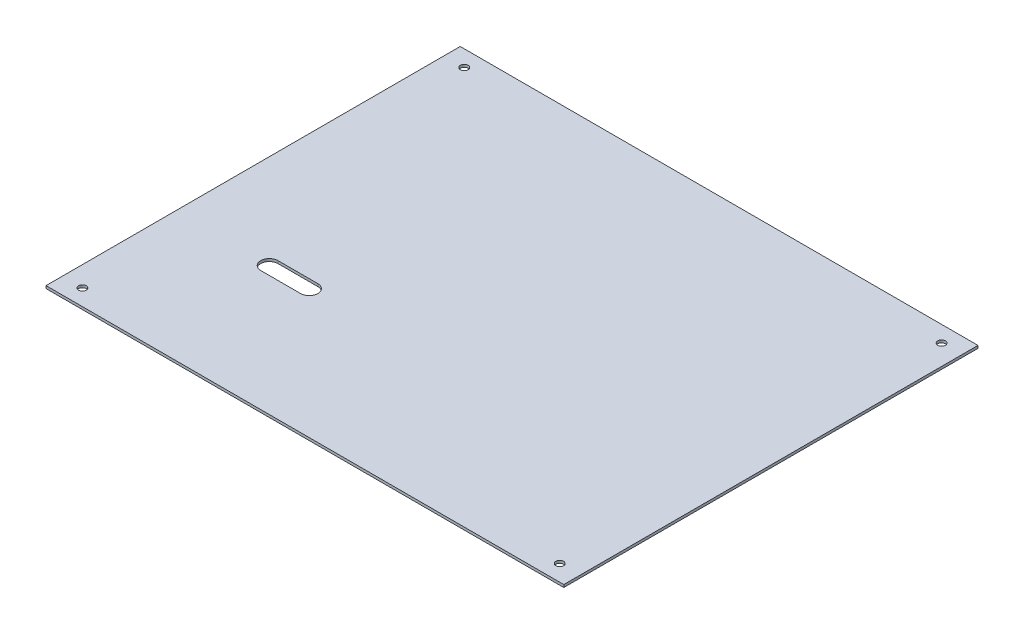
from build123d import *

# Parameters (mm, degrees)
SKETCH1_W           = 200
SKETCH1_H           = 160
SKETCH1_R           = 1.5
BOSS_EXTRUDE1_DEPTH = 1


with BuildPart() as part:
    # Sketch1 → Boss-Extrude1 (new body)
    with BuildSketch(Plane(origin=(0, 0, 0), x_dir=(1, 0, 0), z_dir=(0, 1, 0))):
        Rectangle(SKETCH1_W, SKETCH1_H)
        with Locations(Location((-92.191311906, 73.753049524, 0), (0, 0, 270))):
            Circle(SKETCH1_R, mode=Mode.SUBTRACT)
        with Locations(Location((92.191311906, 73.753049524, 0), (0, 0, 270))):
            Circle(SKETCH1_R, mode=Mode.SUBTRACT)
        with Locations(Location((92.191311906, -73.753049524, 0), (0, 0, 270))):
            Circle(SKETCH1_R, mode=Mode.SUBTRACT)
        with Locations(Location((-92.191311906, -73.753049524, 0), (0, 0, 270))):
            Circle(SKETCH1_R, mode=Mode.SUBTRACT)
        with BuildLine():
            Line((-48.163212674, -33.479677825), (-63.560167059, -33.479677825))
            ThreePointArc((-63.560167059, -33.479677825), (-66.882145086, -30.157699798), (-63.560167059, -26.835721771))
            Line((-63.560167059, -26.835721771), (-48.163212674, -26.835721771))
            ThreePointArc((-48.163212674, -26.835721771), (-44.841234647, -30.157699798), (-48.163212674, -33.479677825))
        make_face(mode=Mode.SUBTRACT)
    extrude(amount=BOSS_EXTRUDE1_DEPTH)


solid = part.part
